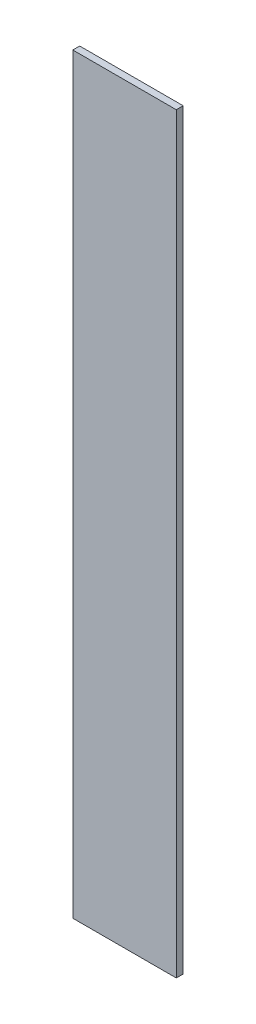
from build123d import *

# Parameters (mm, degrees)
SKETCH1_W           = 30
SKETCH1_H           = 218
BOSS_EXTRUDE1_DEPTH = 2


with BuildPart() as part:
    # Sketch1 → Boss-Extrude1 (new body)
    with BuildSketch(Plane.XY):
        Rectangle(SKETCH1_W, SKETCH1_H)
    extrude(amount=BOSS_EXTRUDE1_DEPTH)


solid = part.part
